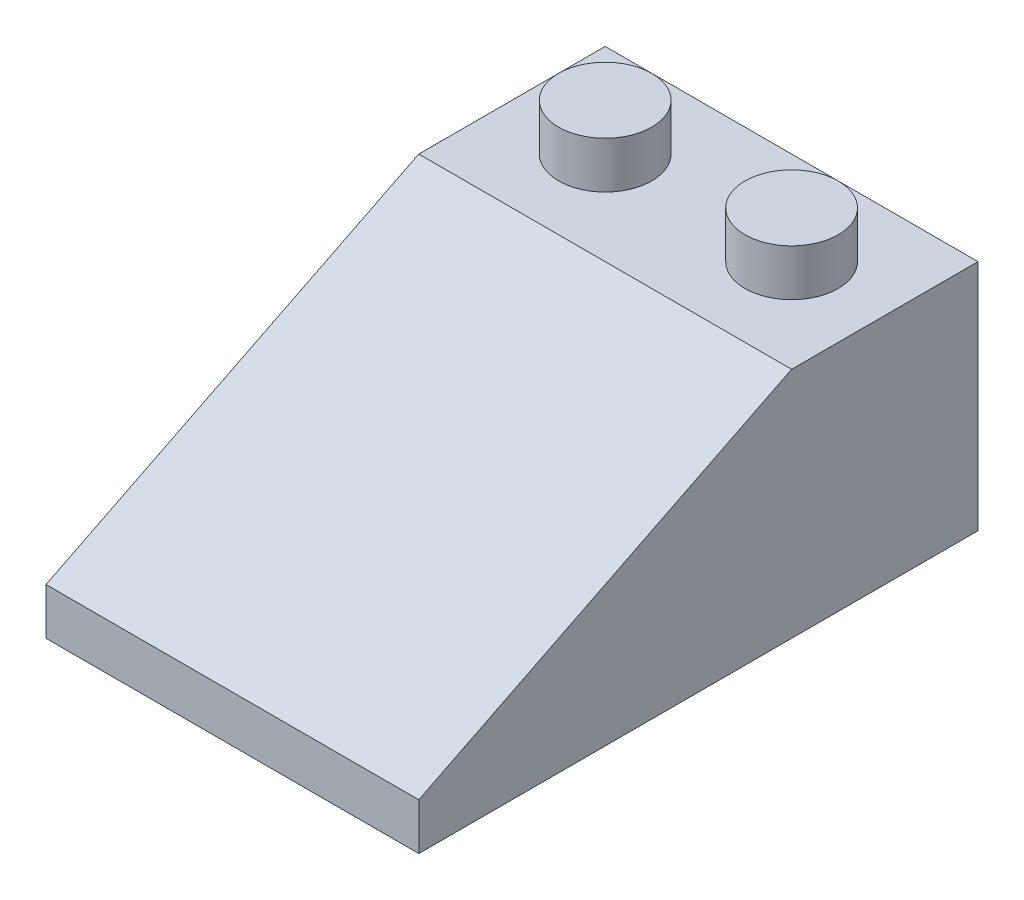
from build123d import *

# Parameters (mm, degrees)
SKETCH1_W           = 24
SKETCH1_H           = 10
BOSS_EXTRUDE1_DEPTH = 16
CUT_EXTRUDE2_DEPTH  = 21.615528128
SKETCH4_R           = 2
BOSS_EXTRUDE2_DEPTH = 2
SHELL1_T            = -1
BOSS_EXTRUDE3_REACH = 25.324
SKETCH6_R           = 2.7
SKETCH6_R_2         = 1.7


with BuildPart() as part:
    # Sketch1 → Boss-Extrude1 (new body)
    with BuildSketch(Plane(origin=(0, 0, 0), x_dir=(0, 0, -1), z_dir=(1, 0, 0))):
        Rectangle(SKETCH1_W, SKETCH1_H)
    extrude(amount=BOSS_EXTRUDE1_DEPTH)

    # Sketch2 → Cut-Extrude2 (cut, through all)
    with BuildSketch(Plane(origin=(16, 0, 0), x_dir=(0, 0, -1), z_dir=(1, 0, 0))):
        Polygon((-12, 5), (-12, -3), (4, 5), align=None)
    extrude(amount=-CUT_EXTRUDE2_DEPTH, mode=Mode.SUBTRACT)

    # Sketch4 → Boss-Extrude2 (add)
    with BuildSketch(Plane(origin=(0, 5, 0), x_dir=(1, 0, 0), z_dir=(0, 1, 0))):
        with Locations((4, 8)):
            Circle(SKETCH4_R)
        with Locations((12, 8)):
            Circle(SKETCH4_R)
    extrude(amount=BOSS_EXTRUDE2_DEPTH)

    # Shell1
    shell1_openings = [part.faces().sort_by_distance(p)[0] for p in [
        (8, -5, 0),
    ]]
    offset(amount=SHELL1_T, openings=shell1_openings, kind=Kind.INTERSECTION)

    # Sketch6 → Boss-Extrude3 (add, up to next)
    with BuildSketch(Plane.XZ.offset(5), mode=Mode.PRIVATE) as boss_extrude3_sk1:
        with Locations((8, 4)):
            Circle(SKETCH6_R)
        with Locations((8, 4)):
            Circle(SKETCH6_R_2, mode=Mode.SUBTRACT)
    boss_extrude3_tool1 = extrude(boss_extrude3_sk1.sketch, amount=-BOSS_EXTRUDE3_REACH, mode=Mode.PRIVATE) - part.part
    # Sketch6 → Boss-Extrude3 (add, up to next)
    with BuildSketch(Plane.XZ.offset(5), mode=Mode.PRIVATE) as boss_extrude3_sk2:
        with Locations((8, -4)):
            Circle(SKETCH6_R)
        with Locations((8, -4)):
            Circle(SKETCH6_R_2, mode=Mode.SUBTRACT)
    boss_extrude3_tool2 = extrude(boss_extrude3_sk2.sketch, amount=-BOSS_EXTRUDE3_REACH, mode=Mode.PRIVATE) - part.part
    add(boss_extrude3_tool1.solids().sort_by_distance((5.376368, -5, 4))[0])
    add(boss_extrude3_tool2.solids().sort_by_distance((5.376368, -5, -4))[0])


solid = part.part
